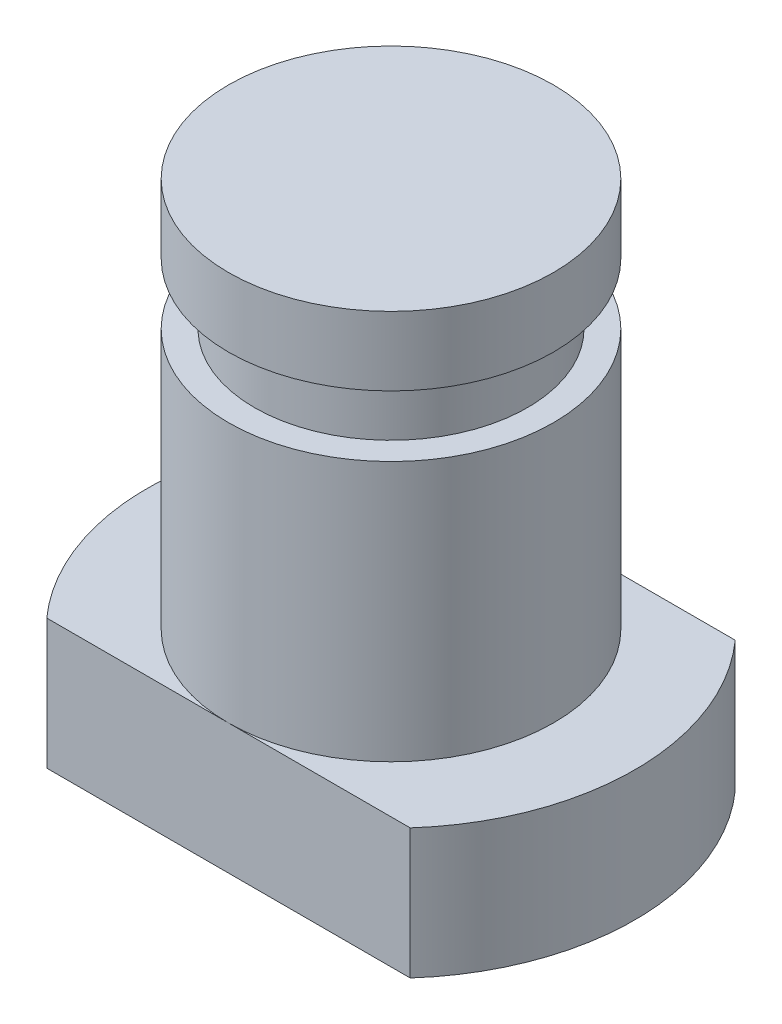
from build123d import *

# Parameters (mm, degrees)
SKETCH1_R           = 3.175
BOSS_EXTRUDE1_DEPTH = 7.62
BOSS_EXTRUDE2_DEPTH = 2.54
SKETCH6_OUTSIDE_W   = 14.587
SKETCH6_OUTSIDE_H   = 11.412
SKETCH6_OUTSIDE_R   = 2.667
CUT_EXTRUDE1_DEPTH  = 1.1938


with BuildPart() as part:
    # Sketch1 → Boss-Extrude1 (new body)
    with BuildSketch(Plane(origin=(0, 0, 0), x_dir=(1, 0, 0), z_dir=(0, 1, 0))):
        with Locations(Location((0, 0, 0), (0, 0, 90))):
            Circle(SKETCH1_R)
    extrude(amount=BOSS_EXTRUDE1_DEPTH)

    # Sketch2 → Boss-Extrude2 (add)
    with BuildSketch(Plane.XZ):
        with BuildLine():
            Line((-3.549757914, 3.175), (3.549757914, 3.175))
            ThreePointArc((3.549757914, 3.175), (4.7625, 0), (3.549757914, -3.175))
            Line((3.549757914, -3.175), (-3.549757914, -3.175))
            ThreePointArc((-3.549757914, -3.175), (-4.7625, 0), (-3.549757914, 3.175))
        make_face()
    extrude(amount=BOSS_EXTRUDE2_DEPTH)

    # Sketch6 outside → Cut-Extrude1 (cut)
    with BuildSketch(Plane(origin=(0, 5.08, 0), x_dir=(1, 0, 0), z_dir=(0, 1, 0))):
        with Locations((0.0005, 0)):
            Rectangle(SKETCH6_OUTSIDE_W, SKETCH6_OUTSIDE_H)
        with Locations(Location((0, 0, 0), (0, 0, 270))):
            Circle(SKETCH6_OUTSIDE_R, mode=Mode.SUBTRACT)
    extrude(amount=CUT_EXTRUDE1_DEPTH, mode=Mode.SUBTRACT)


solid = part.part
